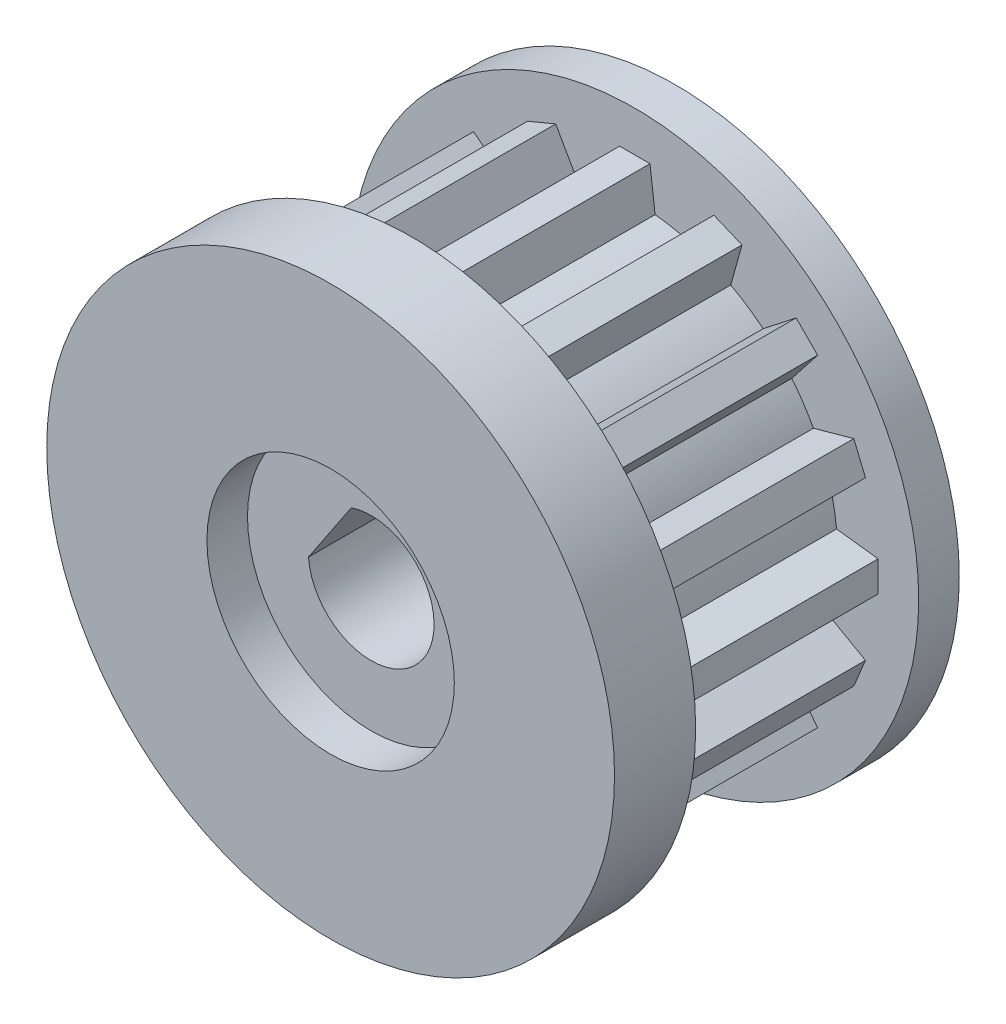
from build123d import *
from build123d.topology import SkipClean

# Parameters (mm, degrees)
SKETCH_1_R          = 3.1
SKETCH_1_W          = 1.5
SKETCH_1_H          = 1.949874371
EXTRUDE_1_DEPTH     = 11
EXTRUDE_START       = 2
SKETCH_3_R          = 14
SKETCH_3_R_2        = 3.1
EXTRUDE_2_DEPTH     = 2
SKETCH_4_R          = 14
SKETCH_4_R_2        = 3.1
EXTRUDE_3_DEPTH     = 2
SKETCH_5_R          = 14
SKETCH_5_R_2        = 6.1
EXTRUDE_4_DEPTH     = 2
EXTRUDE_5_DEPTH     = 15
SKETCH_2_R          = 1.65
CUT_EXTRUDE_3_DEPTH = 25.839484697


with BuildPart() as part:
    # ｽｹｯﾁ1 → ﾎﾞｽ - 押し出し1 (new body)
    # profile 1 of 23: a face of its own
    with BuildSketch(Plane.XY):
        with BuildLine():
            ThreePointArc((-4.731531608, 8.80980185), (-3.826834324, 9.238795325), (-2.883772543, 9.575168715))
            Line((-2.883772543, 9.575168715), (-3.899291539, 11.373566964))
            Line((-3.899291539, 11.373566964), (-5.285110838, 10.799541816))
            Line((-5.285110838, 10.799541816), (-4.731531608, 8.80980185))
        make_face()
    # profile 2 of 23: a face of its own
    with BuildSketch(Plane.XY):
        with BuildLine():
            Line((-0.75, 9.971835338), (-0.75, 12))
            Line((-0.75, 12), (-1, 9.949874371))
            ThreePointArc((-1, 9.949874371), (-0.875068895, 9.961639144), (-0.75, 9.971835338))
        make_face()
    # profile 3 of 23: a face of its own
    with BuildSketch(Plane.XY):
        with BuildLine():
            Line((0.75, 12), (-0.75, 12))
            Line((-0.75, 12), (-0.75, 9.971835338))
            ThreePointArc((-0.75, 9.971835338), (0, 10), (0.75, 9.971835338))
            Line((0.75, 9.971835338), (0.75, 12))
        make_face()
    # profile 4 of 23: a face of its own
    with BuildSketch(Plane.XY):
        with BuildLine():
            Line((1, 9.949874371), (0.75, 12))
            Line((0.75, 12), (0.75, 9.971835338))
            ThreePointArc((0.75, 9.971835338), (0.875068895, 9.961639144), (1, 9.949874371))
        make_face()
    # profile 5 of 23: a face of its own
    with BuildSketch(Plane.XY):
        with BuildLine():
            ThreePointArc((-7.742730421, 6.328516859), (-7.071067812, 7.071067812), (-6.328516859, 7.742730421))
            Line((-6.328516859, 7.742730421), (-7.954951288, 9.01561146))
            Line((-7.954951288, 9.01561146), (-9.01561146, 7.954951288))
            Line((-9.01561146, 7.954951288), (-7.742730421, 6.328516859))
        make_face()
    # profile 6 of 23: a face of its own
    with BuildSketch(Plane.XY):
        with BuildLine():
            ThreePointArc((-9.575168715, 2.883772543), (-9.238795325, 3.826834324), (-8.80980185, 4.731531608))
            Line((-8.80980185, 4.731531608), (-10.799541816, 5.285110838))
            Line((-10.799541816, 5.285110838), (-11.373566964, 3.899291539))
            Line((-11.373566964, 3.899291539), (-9.575168715, 2.883772543))
        make_face()
    # profile 7 of 23: a face of its own
    with BuildSketch(Plane.XY):
        with BuildLine():
            ThreePointArc((-9.949874371, -1), (-10, 0), (-9.949874371, 1))
            Line((-9.949874371, 1), (-12, 0.75))
            Line((-12, 0.75), (-12, -0.75))
            Line((-12, -0.75), (-9.949874371, -1))
        make_face()
    # profile 8 of 23: a face of its own
    with BuildSketch(Plane.XY):
        with BuildLine():
            ThreePointArc((-8.80980185, -4.731531608), (-9.238795325, -3.826834324), (-9.575168715, -2.883772543))
            Line((-9.575168715, -2.883772543), (-11.373566964, -3.899291539))
            Line((-11.373566964, -3.899291539), (-10.799541816, -5.285110838))
            Line((-10.799541816, -5.285110838), (-8.80980185, -4.731531608))
        make_face()
    # profile 9 of 23: a face of its own
    with BuildSketch(Plane.XY):
        with BuildLine():
            ThreePointArc((-6.328516859, -7.742730421), (-7.071067812, -7.071067812), (-7.742730421, -6.328516859))
            Line((-7.742730421, -6.328516859), (-9.01561146, -7.954951288))
            Line((-9.01561146, -7.954951288), (-7.954951288, -9.01561146))
            Line((-7.954951288, -9.01561146), (-6.328516859, -7.742730421))
        make_face()
    # profile 10 of 23: a face of its own
    with BuildSketch(Plane.XY):
        with BuildLine():
            ThreePointArc((-2.883772543, -9.575168715), (-3.826834324, -9.238795325), (-4.731531608, -8.80980185))
            Line((-4.731531608, -8.80980185), (-5.285110838, -10.799541816))
            Line((-5.285110838, -10.799541816), (-3.899291539, -11.373566964))
            Line((-3.899291539, -11.373566964), (-2.883772543, -9.575168715))
        make_face()
    # profile 11 of 23: a face of its own
    with BuildSketch(Plane.XY):
        with BuildLine():
            ThreePointArc((1, -9.949874371), (0, -10), (-1, -9.949874371))
            Line((-1, -9.949874371), (-0.75, -12))
            Line((-0.75, -12), (0.75, -12))
            Line((0.75, -12), (1, -9.949874371))
        make_face()
    # profile 12 of 23: a face of its own
    with BuildSketch(Plane.XY):
        with BuildLine():
            Line((5.285110838, -10.799541816), (4.731531608, -8.80980185))
            ThreePointArc((4.731531608, -8.80980185), (3.826834324, -9.238795325), (2.883772543, -9.575168715))
            Line((2.883772543, -9.575168715), (3.899291539, -11.373566964))
            Line((3.899291539, -11.373566964), (5.285110838, -10.799541816))
        make_face()
    # profile 13 of 23: a face of its own
    with BuildSketch(Plane.XY):
        with BuildLine():
            Line((9.01561146, -7.954951288), (7.742730421, -6.328516859))
            ThreePointArc((7.742730421, -6.328516859), (7.071067812, -7.071067812), (6.328516859, -7.742730421))
            Line((6.328516859, -7.742730421), (7.954951288, -9.01561146))
            Line((7.954951288, -9.01561146), (9.01561146, -7.954951288))
        make_face()
    # profile 14 of 23: a face of its own
    with BuildSketch(Plane.XY):
        with BuildLine():
            Line((11.373566964, -3.899291539), (9.575168715, -2.883772543))
            ThreePointArc((9.575168715, -2.883772543), (9.238795325, -3.826834324), (8.80980185, -4.731531608))
            Line((8.80980185, -4.731531608), (10.799541816, -5.285110838))
            Line((10.799541816, -5.285110838), (11.373566964, -3.899291539))
        make_face()
    # profile 15 of 23: a face of its own
    with BuildSketch(Plane.XY):
        with BuildLine():
            Line((12, 0.75), (9.949874371, 1))
            ThreePointArc((9.949874371, 1), (9.987460731, 0.500627751), (10, 0))
            ThreePointArc((10, 0), (9.987460731, -0.500627751), (9.949874371, -1))
            Line((9.949874371, -1), (12, -0.75))
            Line((12, -0.75), (12, 0.75))
        make_face()
    # profile 16 of 23: a face of its own
    with BuildSketch(Plane.XY):
        with BuildLine():
            Line((10.799541816, 5.285110838), (8.80980185, 4.731531608))
            ThreePointArc((8.80980185, 4.731531608), (9.238795325, 3.826834324), (9.575168715, 2.883772543))
            Line((9.575168715, 2.883772543), (11.373566964, 3.899291539))
            Line((11.373566964, 3.899291539), (10.799541816, 5.285110838))
        make_face()
    # profile 17 of 23: a face of its own
    with BuildSketch(Plane.XY):
        with BuildLine():
            Line((7.954951288, 9.01561146), (6.328516859, 7.742730421))
            ThreePointArc((6.328516859, 7.742730421), (7.071067812, 7.071067812), (7.742730421, 6.328516859))
            Line((7.742730421, 6.328516859), (9.01561146, 7.954951288))
            Line((9.01561146, 7.954951288), (7.954951288, 9.01561146))
        make_face()
    # profile 18 of 23: a face of its own
    with BuildSketch(Plane.XY):
        with BuildLine():
            Line((3.899291539, 11.373566964), (2.883772543, 9.575168715))
            ThreePointArc((2.883772543, 9.575168715), (3.826834324, 9.238795325), (4.731531608, 8.80980185))
            Line((4.731531608, 8.80980185), (5.285110838, 10.799541816))
            Line((5.285110838, 10.799541816), (3.899291539, 11.373566964))
        make_face()
    # profile 19 of 23: a face of its own
    with BuildSketch(Plane.XY):
        with BuildLine():
            Line((-0.75, 9.949874371), (-1, 9.949874371))
            ThreePointArc((-1, 9.949874371), (-1.95090322, 9.807852804), (-2.883772543, 9.575168715))
            ThreePointArc((-2.883772543, 9.575168715), (-3.826834324, 9.238795325), (-4.731531608, 8.80980185))
            ThreePointArc((-4.731531608, 8.80980185), (-5.55570233, 8.314696123), (-6.328516859, 7.742730421))
            ThreePointArc((-6.328516859, 7.742730421), (-7.071067812, 7.071067812), (-7.742730421, 6.328516859))
            ThreePointArc((-7.742730421, 6.328516859), (-8.314696123, 5.55570233), (-8.80980185, 4.731531608))
            ThreePointArc((-8.80980185, 4.731531608), (-9.238795325, 3.826834324), (-9.575168715, 2.883772543))
            ThreePointArc((-9.575168715, 2.883772543), (-9.807852804, 1.95090322), (-9.949874371, 1))
            ThreePointArc((-9.949874371, 1), (-10, 0), (-9.949874371, -1))
            ThreePointArc((-9.949874371, -1), (-9.807852804, -1.95090322), (-9.575168715, -2.883772543))
            ThreePointArc((-9.575168715, -2.883772543), (-9.238795325, -3.826834324), (-8.80980185, -4.731531608))
            ThreePointArc((-8.80980185, -4.731531608), (-8.314696123, -5.55570233), (-7.742730421, -6.328516859))
            ThreePointArc((-7.742730421, -6.328516859), (-7.071067812, -7.071067812), (-6.328516859, -7.742730421))
            ThreePointArc((-6.328516859, -7.742730421), (-5.55570233, -8.314696123), (-4.731531608, -8.80980185))
            ThreePointArc((-4.731531608, -8.80980185), (-3.826834324, -9.238795325), (-2.883772543, -9.575168715))
            ThreePointArc((-2.883772543, -9.575168715), (-1.95090322, -9.807852804), (-1, -9.949874371))
            ThreePointArc((-1, -9.949874371), (0, -10), (1, -9.949874371))
            ThreePointArc((1, -9.949874371), (1.95090322, -9.807852804), (2.883772543, -9.575168715))
            ThreePointArc((2.883772543, -9.575168715), (3.826834324, -9.238795325), (4.731531608, -8.80980185))
            ThreePointArc((4.731531608, -8.80980185), (5.55570233, -8.314696123), (6.328516859, -7.742730421))
            ThreePointArc((6.328516859, -7.742730421), (7.071067812, -7.071067812), (7.742730421, -6.328516859))
            ThreePointArc((7.742730421, -6.328516859), (8.314696123, -5.55570233), (8.80980185, -4.731531608))
            ThreePointArc((8.80980185, -4.731531608), (9.238795325, -3.826834324), (9.575168715, -2.883772543))
            ThreePointArc((9.575168715, -2.883772543), (9.807852804, -1.95090322), (9.949874371, -1))
            ThreePointArc((9.949874371, -1), (9.987460731, -0.500627751), (10, 0))
            ThreePointArc((10, 0), (9.987460731, 0.500627751), (9.949874371, 1))
            ThreePointArc((9.949874371, 1), (9.807852804, 1.95090322), (9.575168715, 2.883772543))
            ThreePointArc((9.575168715, 2.883772543), (9.238795325, 3.826834324), (8.80980185, 4.731531608))
            ThreePointArc((8.80980185, 4.731531608), (8.314696123, 5.55570233), (7.742730421, 6.328516859))
            ThreePointArc((7.742730421, 6.328516859), (7.071067812, 7.071067812), (6.328516859, 7.742730421))
            ThreePointArc((6.328516859, 7.742730421), (5.55570233, 8.314696123), (4.731531608, 8.80980185))
            ThreePointArc((4.731531608, 8.80980185), (3.826834324, 9.238795325), (2.883772543, 9.575168715))
            ThreePointArc((2.883772543, 9.575168715), (1.95090322, 9.807852804), (1, 9.949874371))
            Line((1, 9.949874371), (0.75, 9.949874371))
            Line((0.75, 9.949874371), (0.75, 8))
            Line((0.75, 8), (-0.75, 8))
            Line((-0.75, 8), (-0.75, 9.949874371))
        make_face()
        Circle(SKETCH_1_R, mode=Mode.SUBTRACT)
    # profile 20 of 23: a face of its own
    with BuildSketch(Plane.XY):
        with Locations((0, 8.974937185)):
            Rectangle(SKETCH_1_W, SKETCH_1_H)
    # profile 21 of 23: a face of its own
    with BuildSketch(Plane.XY):
        with BuildLine():
            ThreePointArc((0.75, 9.971835338), (0, 10), (-0.75, 9.971835338))
            Line((-0.75, 9.971835338), (-0.75, 9.949874371))
            Line((-0.75, 9.949874371), (0.75, 9.949874371))
            Line((0.75, 9.949874371), (0.75, 9.971835338))
        make_face()
    # profile 22 of 23: a face of its own
    with BuildSketch(Plane.XY):
        with BuildLine():
            ThreePointArc((-0.75, 9.971835338), (-0.875068895, 9.961639144), (-1, 9.949874371))
            Line((-1, 9.949874371), (-0.75, 9.949874371))
            Line((-0.75, 9.949874371), (-0.75, 9.971835338))
        make_face()
    # profile 23 of 23: a face of its own
    with BuildSketch(Plane.XY):
        with BuildLine():
            ThreePointArc((1, 9.949874371), (0.875068895, 9.961639144), (0.75, 9.971835338))
            Line((0.75, 9.971835338), (0.75, 9.949874371))
            Line((0.75, 9.949874371), (1, 9.949874371))
        make_face()
    extrude(amount=EXTRUDE_1_DEPTH)

    # ｽｹｯﾁ3 → ﾎﾞｽ - 押し出し2 (add)
    with SkipClean():  # the faces are left unmerged after this step: merging them gives an invalid solid
        with BuildSketch(Plane(origin=(0, 0, 0), x_dir=(-1, 0, 0), z_dir=(0, 0, -1)).offset(EXTRUDE_START)):
            Circle(SKETCH_3_R)
            Circle(SKETCH_3_R_2, mode=Mode.SUBTRACT)
        extrude(amount=-EXTRUDE_2_DEPTH)

    # ｽｹｯﾁ4 → ﾎﾞｽ - 押し出し3 (add)
    with BuildSketch(Plane.XY.offset(11)):
        with Locations(Location((0, 0, 0), (0, 0, 180))):
            Circle(SKETCH_4_R)
        with Locations(Location((0, 0, 0), (0, 0, 180))):
            Circle(SKETCH_4_R_2, mode=Mode.SUBTRACT)
    extrude(amount=EXTRUDE_3_DEPTH)

    # ｽｹｯﾁ5 → ﾎﾞｽ - 押し出し4 (add)
    with BuildSketch(Plane.XY.offset(13)):
        with Locations(Location((0, 0, 0), (0, 0, 180))):
            Circle(SKETCH_5_R)
        Circle(SKETCH_5_R_2, mode=Mode.SUBTRACT)
    extrude(amount=EXTRUDE_4_DEPTH)

    # ｽｹｯﾁ6 → ﾎﾞｽ - 押し出し5 (add)
    with BuildSketch(Plane(origin=(0, 0, -2), x_dir=(-1, 0, 0), z_dir=(0, 0, -1))):
        with BuildLine():
            Line((0.981092844, 2.940655851), (3.09225973, -0.218928676))
            ThreePointArc((3.09225973, -0.218928676), (2.577555798, 1.722267722), (0.981092844, 2.940655851))
        make_face()
    extrude(amount=-EXTRUDE_5_DEPTH)

    # ｽｹｯﾁ2 → ｶｯﾄ - 押し出し3 (cut, through all)
    with BuildSketch(Plane(origin=(0, 0, 0), x_dir=(0, 0, -1), z_dir=(0.8314696123025446, -0.5555702330196034, 0))):
        with Locations(Location((-5.5, 0, 0), (0, 0, 90))):
            Circle(SKETCH_2_R)
    extrude(amount=-CUT_EXTRUDE_3_DEPTH, mode=Mode.SUBTRACT)


solid = part.part
